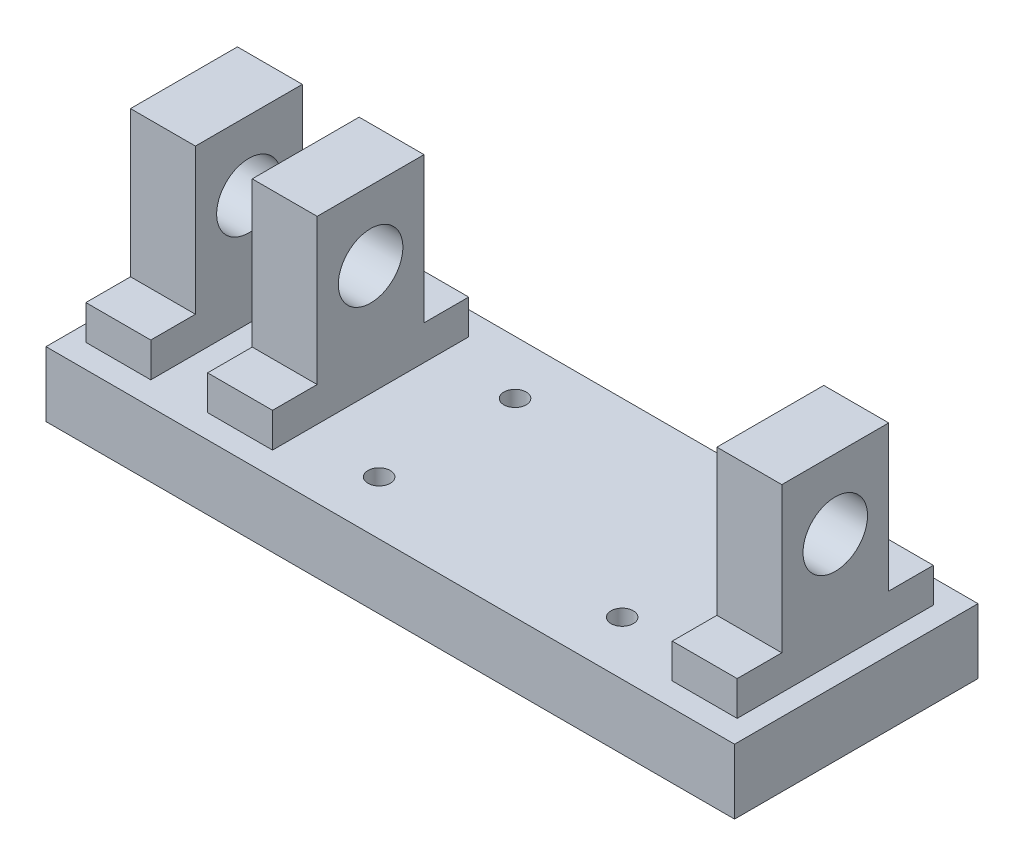
from build123d import *

# Parameters (mm, degrees)
SKETCH1_W           = 169.7
SKETCH1_H           = 60
SKETCH1_R           = 2.75
BOSS_EXTRUDE1_DEPTH = 16
BOSS_EXTRUDE2_START = -5.18
SKETCH2_W           = 48.35
SKETCH2_H           = 8.5
SKETCH2_W_2         = 26.35
SKETCH2_H_2         = 35.9
SKETCH2_R           = 7.95
BOSS_EXTRUDE2_DEPTH = 16
BOSS_EXTRUDE3_START = -149.7
SKETCH2_3_W         = 48.35
SKETCH2_3_H         = 8.5
SKETCH2_3_W_2       = 26.35
SKETCH2_3_H_2       = 35.9
SKETCH2_3_R         = 7.95
BOSS_EXTRUDE3_DEPTH = 16
LPATTERN1_COUNT     = 2
LPATTERN1_PITCH     = 30


with BuildPart() as part:
    # Sketch1 → Boss-Extrude1 (new body)
    with BuildSketch(Plane(origin=(0, 0, 0), x_dir=(1, 0, 0), z_dir=(0, 1, 0))):
        Rectangle(SKETCH1_W, SKETCH1_H)
        with Locations(Location((-16, -16.75, 0), (0, 0, 270))):
            Circle(SKETCH1_R, mode=Mode.SUBTRACT)
        with Locations(Location((43.9, -16.75, 0), (0, 0, 270))):
            Circle(SKETCH1_R, mode=Mode.SUBTRACT)
        with Locations(Location((43.9, 16.75, 0), (0, 0, 270))):
            Circle(SKETCH1_R, mode=Mode.SUBTRACT)
        with Locations(Location((-16, 16.75, 0), (0, 0, 270))):
            Circle(SKETCH1_R, mode=Mode.SUBTRACT)
    extrude(amount=BOSS_EXTRUDE1_DEPTH)

    # Sketch2 → Boss-Extrude2 (add)
    # profile 1 of 2: a face of its own
    with BuildSketch(Plane(origin=(84.85, 0, 0), x_dir=(0, 0, -1), z_dir=(1, 0, 0)).offset(BOSS_EXTRUDE2_START)):
        with Locations((0, 20.25)):
            Rectangle(SKETCH2_W, SKETCH2_H)
    # profile 2 of 2: a face of its own
    with BuildSketch(Plane(origin=(84.85, 0, 0), x_dir=(0, 0, -1), z_dir=(1, 0, 0)).offset(BOSS_EXTRUDE2_START)):
        with Locations((0, 42.45)):
            Rectangle(SKETCH2_W_2, SKETCH2_H_2)
        with Locations((0, 43.25)):
            Circle(SKETCH2_R, mode=Mode.SUBTRACT)
    extrude(amount=-BOSS_EXTRUDE2_DEPTH)

    # Sketch2<3> → Boss-Extrude3 (add)
    # profile 1 of 2: a face of its own
    with BuildSketch(Plane(origin=(84.85, 0, 0), x_dir=(0, 0, -1), z_dir=(1, 0, 0)).offset(BOSS_EXTRUDE3_START)):
        with Locations((0, 20.25)):
            Rectangle(SKETCH2_3_W, SKETCH2_3_H)
    # profile 2 of 2: a face of its own
    with BuildSketch(Plane(origin=(84.85, 0, 0), x_dir=(0, 0, -1), z_dir=(1, 0, 0)).offset(BOSS_EXTRUDE3_START)):
        with Locations((0, 42.45)):
            Rectangle(SKETCH2_3_W_2, SKETCH2_3_H_2)
        with Locations((0, 43.25)):
            Circle(SKETCH2_3_R, mode=Mode.SUBTRACT)
    boss_extrude3 = extrude(amount=-BOSS_EXTRUDE3_DEPTH)

    # LPattern1: Boss-Extrude3 ×2
    with Locations(*[(i * LPATTERN1_PITCH, 0, 0) for i in range(1, LPATTERN1_COUNT)]):
        add(boss_extrude3)


solid = part.part
